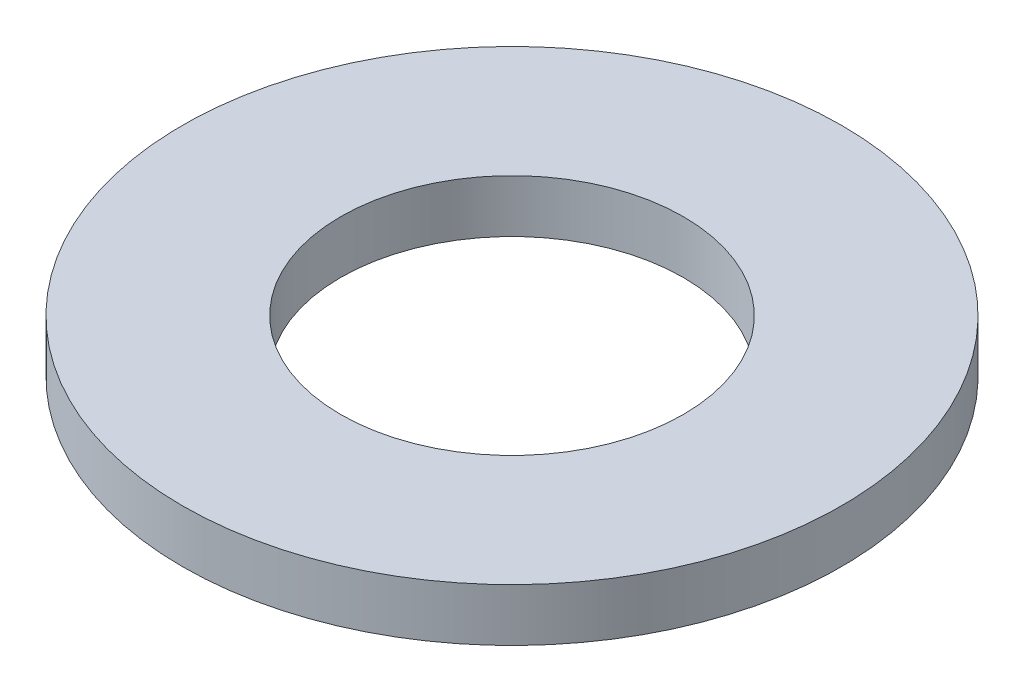
from build123d import *

# Parameters (mm, degrees)
SKETCH1_R           = 9.525
SKETCH1_R_2         = 4.953
BOSS_EXTRUDE1_DEPTH = 1.524


with BuildPart() as part:
    # Sketch1 → Boss-Extrude1 (new body)
    with BuildSketch(Plane(origin=(0, 0, 0), x_dir=(1, 0, 0), z_dir=(0, 1, 0))):
        with Locations(Location((0, 0, 0), (0, 0, 90))):
            Circle(SKETCH1_R)
        with Locations(Location((0, 0, 0), (0, 0, 90))):
            Circle(SKETCH1_R_2, mode=Mode.SUBTRACT)
    extrude(amount=BOSS_EXTRUDE1_DEPTH)


solid = part.part
